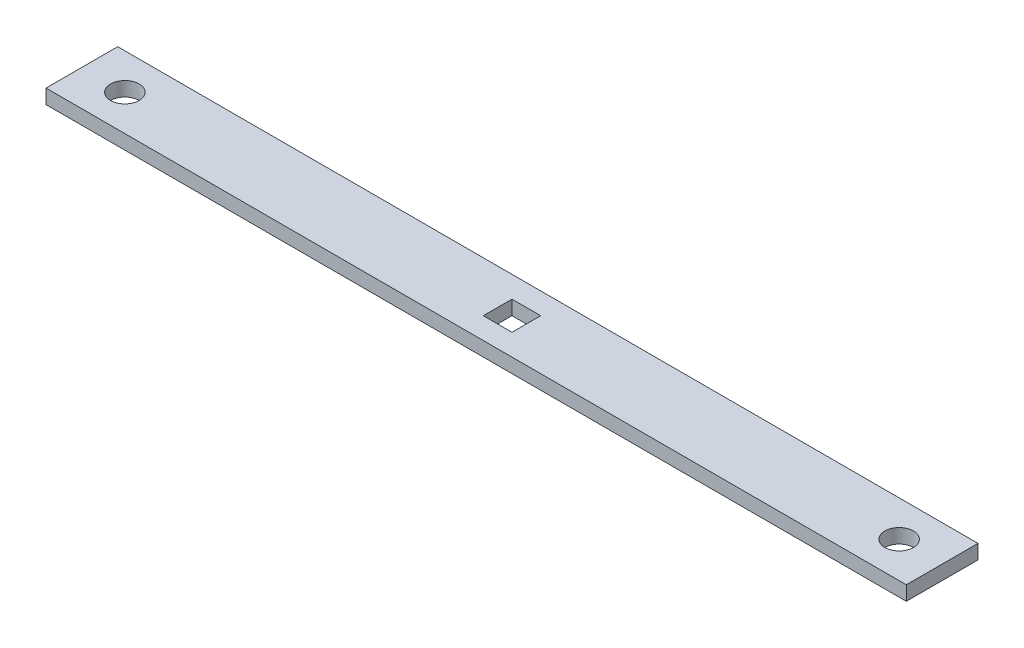
from build123d import *

# Parameters (mm, degrees)
SKETCH2_W               = 30
SKETCH2_H               = 2.5
BOSS_EXTRUDE1_DEPTH     = 0.5
CUT_EXTRUDE1_DEPTH      = 16.060295482
CUT_EXTRUDE1_DEPTH_BACK = 16.060295482
SKETCH3_R               = 0.5
SKETCH3_W               = 1
SKETCH3_H               = 1


with BuildPart() as part:
    # Sketch2 → Boss-Extrude1 (new body)
    with BuildSketch(Plane(origin=(0, 0, 0), x_dir=(1, 0, 0), z_dir=(0, 1, 0))):
        Rectangle(SKETCH2_W, SKETCH2_H)
    extrude(amount=BOSS_EXTRUDE1_DEPTH)

    # Sketch3 → Cut-Extrude1 (cut, two sides: drawn at the far end of the back side and taken through both)
    with BuildSketch(Plane(origin=(0, 0.5, 0), x_dir=(1, 0, 0), z_dir=(0, 1, 0)).offset(-CUT_EXTRUDE1_DEPTH_BACK)):
        with Locations(Location((-13.5, 0, 0), (0, 0, 270))):
            Circle(SKETCH3_R)
        with Locations(Location((13.5, 0, 0), (0, 0, 270))):
            Circle(SKETCH3_R)
        Rectangle(SKETCH3_W, SKETCH3_H)
    extrude(amount=CUT_EXTRUDE1_DEPTH + CUT_EXTRUDE1_DEPTH_BACK, mode=Mode.SUBTRACT)


solid = part.part
